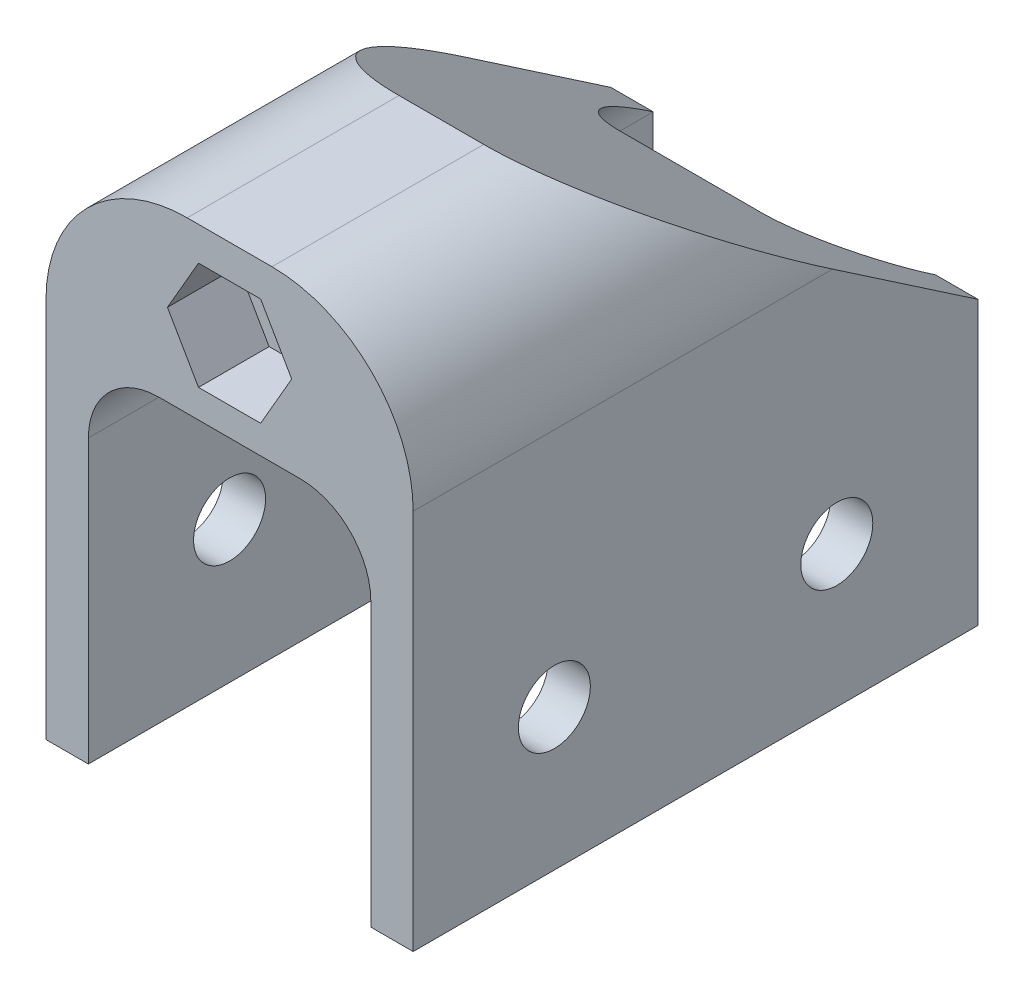
from build123d import *

# Parameters (mm, degrees)
EXTRUDE_1_DEPTH     = 40
CUT_EXTRUDE_1_DEPTH = 61.373835392
SKETCH_3_R          = 2.55
CUT_EXTRUDE_2_DEPTH = 61.373835392
CUT_EXTRUDE_3_DEPTH = 5
SKETCH_6_R          = 2.55
CUT_EXTRUDE_4_DEPTH = 1


with BuildPart() as part:
    # Эскиз1 → Бобышка-Вытянуть1 (new body)
    with BuildSketch(Plane.XY):
        with BuildLine():
            Line((0, 0), (0, 20))
            ThreePointArc((0, 20), (1.464466094, 23.535533906), (5, 25))
            Line((5, 25), (15, 25))
            ThreePointArc((15, 25), (18.535533906, 23.535533906), (20, 20))
            Line((20, 20), (20, 0))
            Line((20, 0), (23, 0))
            Line((23, 0), (23, 27))
            ThreePointArc((23, 27), (20.071067812, 34.071067812), (13, 37))
            Line((13, 37), (7, 37))
            ThreePointArc((7, 37), (-0.071067812, 34.071067812), (-3, 27))
            Line((-3, 27), (-3, 0))
            Line((-3, 0), (0, 0))
        make_face()
    extrude(amount=EXTRUDE_1_DEPTH)

    # Эскиз2 → Вырез-Вытянуть1 (cut, through all)
    with BuildSketch(Plane(origin=(23, 0, 0), x_dir=(0, 0, -1), z_dir=(1, 0, 0))):
        Polygon((0, 20), (-25, 37), (0, 37), align=None)
    extrude(amount=-CUT_EXTRUDE_1_DEPTH, mode=Mode.SUBTRACT)

    # Эскиз3 → Вырез-Вытянуть2 (cut, through all)
    with BuildSketch(Plane(origin=(23, 0, 0), x_dir=(0, 0, -1), z_dir=(1, 0, 0))):
        with Locations((-30, 10)):
            Circle(SKETCH_3_R)
        with Locations((-10, 10)):
            Circle(SKETCH_3_R)
    extrude(amount=-CUT_EXTRUDE_2_DEPTH, mode=Mode.SUBTRACT)

    # Эскиз4 → Вырез-Вытянуть3 (cut)
    with BuildSketch(Plane.XY.offset(40)):
        Polygon((5.6, 30.810511777), (7.8, 27), (12.2, 27), (14.4, 30.810511777), (12.2, 34.621023553), (7.8, 34.621023553), align=None)
    extrude(amount=-CUT_EXTRUDE_3_DEPTH, mode=Mode.SUBTRACT)

    # Эскиз6 → Вырез-Вытянуть4 (cut)
    with BuildSketch(Plane.XY.offset(35)):
        with Locations((10, 30.810511777)):
            Circle(SKETCH_6_R)
    extrude(amount=-CUT_EXTRUDE_4_DEPTH, mode=Mode.SUBTRACT)


solid = part.part
